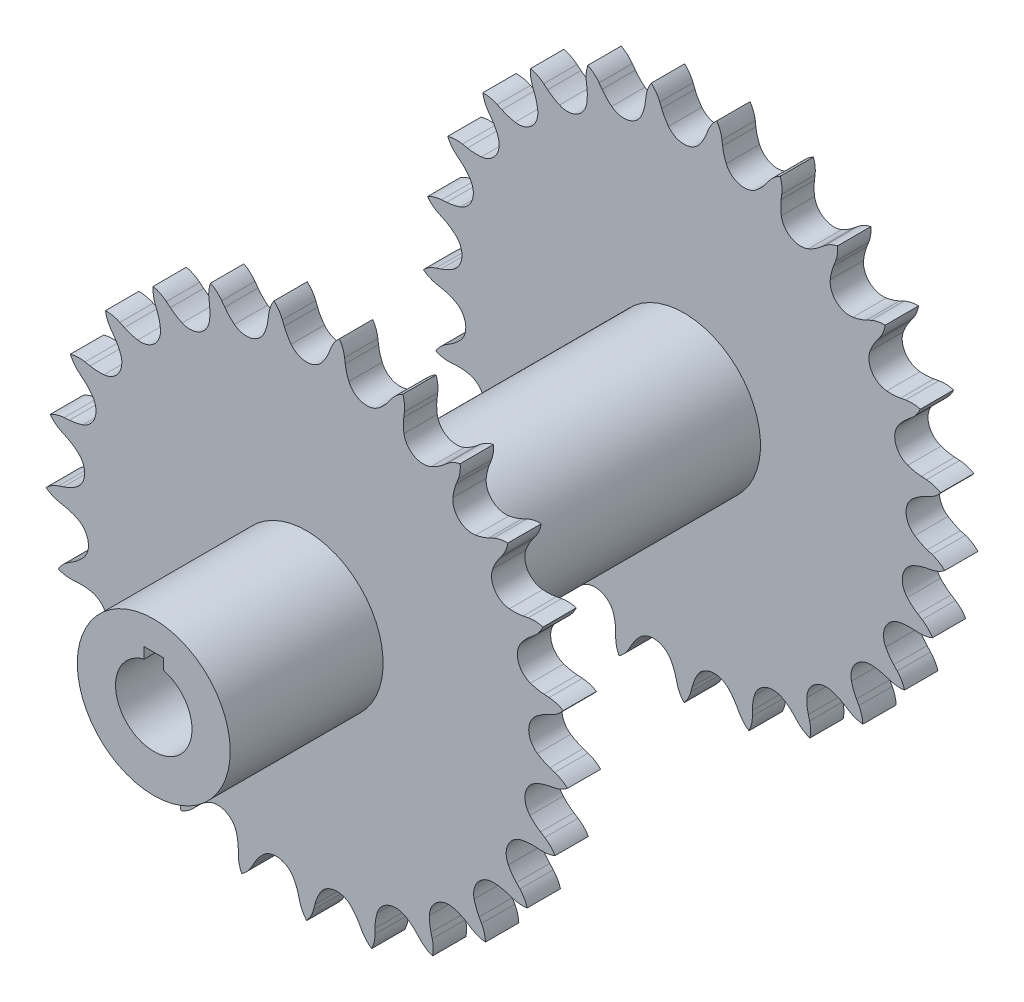
from build123d import *

# Parameters (mm, degrees)
BOSS_EXTRUDE1_DEPTH     = 8.712
SKETCH2_R               = 20
BOSS_EXTRUDE2_DEPTH     = 90
SKETCH4_R               = 20
BOSS_EXTRUDE3_DEPTH     = 40
CUT_EXTRUDE1_DEPTH      = 177.215580083
CUT_EXTRUDE1_DEPTH_BACK = 138.712


with BuildPart() as part:
    # Sketch1 → Boss-Extrude1 (new body)
    with BuildSketch(Plane.XY):
        with BuildLine():
            Line((5.857410324, 63.38143254), (6.35117384, 64.625997594))
            ThreePointArc((6.35117384, 64.625997594), (7.272282782, 66.3354149), (8.563342239, 67.785833699))
            ThreePointArc((8.563342239, 67.785833699), (9.453136201, 66.059909043), (9.920192015, 64.175125746))
            Line((9.920192015, 64.175125746), (10.088932299, 62.846866999))
            ThreePointArc((10.088932299, 62.846866999), (10.441933509, 61.06080873), (11.03646788, 59.340011568))
            ThreePointArc((11.03646788, 59.340011568), (14.476238332, 56.381225809), (18.915938066, 57.316907482))
            ThreePointArc((18.915938066, 57.316907482), (20.265932863, 58.538434412), (21.435710315, 59.933509574))
            Line((21.435710315, 59.933509574), (22.223472084, 61.016180335))
            ThreePointArc((22.223472084, 61.016180335), (23.540757492, 62.442822674), (25.151960429, 63.526600469))
            ThreePointArc((25.151960429, 63.526600469), (25.58457987, 61.63361615), (25.568235721, 59.691894728))
            Line((25.568235721, 59.691894728), (25.401350201, 58.36340167))
            ThreePointArc((25.401350201, 58.36340167), (25.2990866, 56.545667875), (25.446997729, 54.731078034))
            ThreePointArc((25.446997729, 54.731078034), (28.042881369, 51.009811845), (32.575794342, 50.811988931))
            ThreePointArc((32.575794342, 50.811988931), (34.187157965, 51.659409293), (35.667125791, 52.719743781))
            Line((35.667125791, 52.719743781), (36.699387845, 53.572492064))
            ThreePointArc((36.699387845, 53.572492064), (38.330079832, 54.626718251), (40.160188444, 55.275757296))
            ThreePointArc((40.160188444, 55.275757296), (40.108450292, 53.334656481), (39.609733144, 51.458002433))
            Line((39.609733144, 51.458002433), (39.11770785, 50.212749168))
            ThreePointArc((39.11770785, 50.212749168), (38.566605036, 48.477554747), (38.258599122, 46.683189581))
            ThreePointArc((38.258599122, 46.683189581), (39.847487036, 42.433263802), (44.188793654, 41.114366243))
            ThreePointArc((44.188793654, 41.114366243), (45.960278199, 41.534433498), (47.657444579, 42.193402597))
            Line((47.657444579, 42.193402597), (48.869346097, 42.76264709))
            ThreePointArc((48.869346097, 42.76264709), (50.710982288, 43.378216217), (52.645004119, 43.551735003))
            ThreePointArc((52.645004119, 43.551735003), (52.112159274, 41.684484195), (51.162405359, 39.990814595))
            Line((51.162405359, 39.990814595), (50.376156051, 38.907044967))
            ThreePointArc((50.376156051, 38.907044967), (49.41084184, 37.363418566), (48.666272027, 35.702024637))
            ThreePointArc((48.666272027, 35.702024637), (49.148328543, 31.190477736), (53.025248546, 28.833376716))
            ThreePointArc((53.025248546, 28.833376716), (54.845545125, 28.799696494), (56.653270853, 29.015894751))
            Line((56.653270853, 29.015894751), (57.968663604, 29.26586773))
            ThreePointArc((57.968663604, 29.26586773), (59.905527225, 29.404101324), (61.821940571, 29.091197028))
            ThreePointArc((61.821940571, 29.091197028), (60.841469634, 27.415122461), (59.500355483, 26.010856801))
            Line((59.500355483, 26.010856801), (58.469285096, 25.15666804))
            ThreePointArc((58.469285096, 25.15666804), (57.15041373, 23.901601383), (56.016064079, 22.477570182))
            ThreePointArc((56.016064079, 22.477570182), (55.360999814, 17.987879243), (58.529932058, 14.740680087))
            ThreePointArc((58.529932058, 14.740680087), (60.284664742, 14.255368641), (62.089363762, 14.015211525))
            Line((62.089363762, 14.015211525), (63.425596784, 13.930206269))
            ThreePointArc((63.425596784, 13.930206269), (65.335987569, 13.582418605), (67.114377132, 12.802752153))
            ThreePointArc((67.114377132, 12.802752153), (65.747886697, 11.423167758), (64.099679445, 10.396541213))
            Line((64.099679445, 10.396541213), (62.888573923, 9.825605141))
            ThreePointArc((62.888573923, 9.825605141), (61.299014942, 8.937958682), (59.846160812, 7.840767326))
            ThreePointArc((59.846160812, 7.840767326), (58.095135862, 3.655036142), (60.356964681, -0.278227683))
            ThreePointArc((60.356964681, -0.278227683), (61.935877163, -1.184676451), (63.624153598, -1.866098985))
            Line((63.624153598, -1.866098985), (64.897266455, -2.280741285))
            ThreePointArc((64.897266455, -2.280741285), (66.661147526, -3.092697429), (68.189770548, -4.290136724))
            ThreePointArc((68.189770548, -4.290136724), (66.523122236, -5.286546587), (64.671384805, -5.871027296))
            Line((64.671384805, -5.871027296), (63.356342363, -6.122836666))
            ThreePointArc((63.356342363, -6.122836666), (61.595973602, -6.587288835), (59.915903162, -7.288699777))
            ThreePointArc((59.915903162, -7.288699777), (57.178940865, -10.907466322), (58.391547236, -15.279653385))
            ThreePointArc((58.391547236, -15.279653385), (59.695430637, -16.550283965), (61.16120387, -17.630155634))
            Line((61.16120387, -17.630155634), (62.291202199, -18.348381475))
            ThreePointArc((62.291202199, -18.348381475), (63.79774242, -19.573487908), (64.980549896, -21.113460533))
            ThreePointArc((64.980549896, -21.113460533), (63.118465349, -21.664087767), (61.179549213, -21.769697567))
            Line((61.179549213, -21.769697567), (59.843198804, -21.686558126))
            ThreePointArc((59.843198804, -21.686558126), (58.022630707, -21.698632768), (56.220908962, -21.960191067))
            ThreePointArc((56.220908962, -21.960191067), (52.669982724, -24.784612562), (52.757174129, -29.32100227))
            ThreePointArc((52.757174129, -29.32100227), (53.704100659, -30.87597627), (54.855270768, -32.286444764))
            Line((54.855270768, -32.286444764), (55.771152617, -33.263125377))
            ThreePointArc((55.771152617, -33.263125377), (56.925690527, -34.824404156), (57.688362313, -36.610147967))
            ThreePointArc((57.688362313, -36.610147967), (55.747843151, -36.680394638), (53.843577542, -36.300497677))
            Line((53.843577542, -36.300497677), (52.569886977, -35.887633382))
            ThreePointArc((52.569886977, -35.887633382), (50.803512533, -35.446571802), (48.993348285, -35.251842789))
            ThreePointArc((48.993348285, -35.251842789), (44.851575862, -37.104450443), (43.807873744, -41.520004748))
            ThreePointArc((43.807873744, -41.520004748), (44.338344527, -43.261617431), (45.102579259, -44.914057829))
            Line((45.102579259, -44.914057829), (45.746796405, -46.087824778))
            ThreePointArc((45.746796405, -46.087824778), (46.47678814, -47.887175016), (46.771402762, -49.806485162))
            ThreePointArc((46.771402762, -49.806485162), (44.874378942, -49.391937413), (43.124415871, -48.550404014))
            Line((43.124415871, -48.550404014), (41.993415811, -47.833756647))
            ThreePointArc((41.993415811, -47.833756647), (40.392222824, -46.967272367), (38.687355351, -46.328491581))
            ThreePointArc((38.687355351, -46.328491581), (34.214979536, -47.092879243), (32.105963537, -51.110152627))
            ThreePointArc((32.105963537, -51.110152627), (32.186647144, -52.928972065), (32.515926821, -54.719555458))
            Line((32.515926821, -54.719555458), (32.84800073, -56.016656649))
            ThreePointArc((32.84800073, -56.016656649), (33.107578224, -57.941018553), (32.915623963, -59.873297718))
            ThreePointArc((32.915623963, -59.873297718), (31.181292467, -59.000003109), (29.69558855, -57.749709911))
            Line((29.69558855, -57.749709911), (28.77834389, -56.774309062))
            ThreePointArc((28.77834389, -56.774309062), (27.442941202, -55.536846475), (25.950493597, -54.494150863))
            ThreePointArc((25.950493597, -54.494150863), (21.428530212, -54.122289244), (18.386717564, -57.488861646))
            ThreePointArc((18.386717564, -57.488861646), (18.012544346, -59.270604724), (17.886179114, -61.086822173))
            Line((17.886179114, -61.086822173), (17.885244362, -62.425755968))
            ThreePointArc((17.885244362, -62.425755968), (17.658097408, -64.354214802), (16.991635455, -66.17805078))
            ThreePointArc((16.991635455, -66.17805078), (15.52897071, -64.900881624), (14.400878188, -63.320389145))
            Line((14.400878188, -63.320389145), (13.755022783, -62.147522837))
            ThreePointArc((13.755022783, -62.147522837), (12.769318657, -60.616836269), (11.583066892, -59.23574223))
            ThreePointArc((11.583066892, -59.23574223), (7.295647526, -57.750996764), (3.512166505, -60.25533406))
            ThreePointArc((3.512166505, -60.25533406), (2.706647142, -61.888047307), (2.132576994, -63.615779189))
            Line((2.132576994, -63.615779189), (1.798692314, -64.912415454))
            ThreePointArc((1.798692314, -64.912415454), (1.099093389, -66.723799057), (0, -68.324593526))
            ThreePointArc((0, -68.324593526), (-1.099093389, -66.723799057), (-1.798692314, -64.912415454))
            Line((-1.798692314, -64.912415454), (-2.132576994, -63.615779189))
            ThreePointArc((-2.132576994, -63.615779189), (-2.706647142, -61.888047307), (-3.512166505, -60.25533406))
            ThreePointArc((-3.512166505, -60.25533406), (-7.295647526, -57.750996764), (-11.583066892, -59.23574223))
            ThreePointArc((-11.583066892, -59.23574223), (-12.769318657, -60.616836269), (-13.755022783, -62.147522837))
            Line((-13.755022783, -62.147522837), (-14.400878188, -63.320389145))
            ThreePointArc((-14.400878188, -63.320389145), (-15.52897071, -64.900881624), (-16.991635455, -66.17805078))
            ThreePointArc((-16.991635455, -66.17805078), (-17.658097408, -64.354214802), (-17.885244362, -62.425755968))
            Line((-17.885244362, -62.425755968), (-17.886179114, -61.086822173))
            ThreePointArc((-17.886179114, -61.086822173), (-18.012544346, -59.270604724), (-18.386717564, -57.488861646))
            ThreePointArc((-18.386717564, -57.488861646), (-21.428530212, -54.122289244), (-25.950493597, -54.494150863))
            ThreePointArc((-25.950493597, -54.494150863), (-27.442941202, -55.536846475), (-28.77834389, -56.774309062))
            Line((-28.77834389, -56.774309062), (-29.69558855, -57.749709911))
            ThreePointArc((-29.69558855, -57.749709911), (-31.181292467, -59.000003109), (-32.915623963, -59.873297718))
            ThreePointArc((-32.915623963, -59.873297718), (-33.107578224, -57.941018553), (-32.84800073, -56.016656649))
            Line((-32.84800073, -56.016656649), (-32.515926821, -54.719555458))
            ThreePointArc((-32.515926821, -54.719555458), (-32.186647144, -52.928972065), (-32.105963537, -51.110152627))
            ThreePointArc((-32.105963537, -51.110152627), (-34.214979536, -47.092879243), (-38.687355351, -46.328491581))
            ThreePointArc((-38.687355351, -46.328491581), (-40.392222824, -46.967272367), (-41.993415811, -47.833756647))
            Line((-41.993415811, -47.833756647), (-43.124415871, -48.550404014))
            ThreePointArc((-43.124415871, -48.550404014), (-44.874378942, -49.391937413), (-46.771402762, -49.806485162))
            ThreePointArc((-46.771402762, -49.806485162), (-46.47678814, -47.887175016), (-45.746796405, -46.087824778))
            Line((-45.746796405, -46.087824778), (-45.102579259, -44.914057829))
            ThreePointArc((-45.102579259, -44.914057829), (-44.338344527, -43.261617431), (-43.807873744, -41.520004748))
            ThreePointArc((-43.807873744, -41.520004748), (-44.851575862, -37.104450443), (-48.993348285, -35.251842789))
            ThreePointArc((-48.993348285, -35.251842789), (-50.803512533, -35.446571802), (-52.569886977, -35.887633382))
            Line((-52.569886977, -35.887633382), (-53.843577542, -36.300497677))
            ThreePointArc((-53.843577542, -36.300497677), (-55.747843151, -36.680394638), (-57.688362313, -36.610147967))
            ThreePointArc((-57.688362313, -36.610147967), (-56.925690527, -34.824404156), (-55.771152617, -33.263125377))
            Line((-55.771152617, -33.263125377), (-54.855270768, -32.286444764))
            ThreePointArc((-54.855270768, -32.286444764), (-53.704100659, -30.87597627), (-52.757174129, -29.32100227))
            ThreePointArc((-52.757174129, -29.32100227), (-52.669982724, -24.784612562), (-56.220908962, -21.960191067))
            ThreePointArc((-56.220908962, -21.960191067), (-58.022630707, -21.698632768), (-59.843198804, -21.686558126))
            Line((-59.843198804, -21.686558126), (-61.179549213, -21.769697567))
            ThreePointArc((-61.179549213, -21.769697567), (-63.118465349, -21.664087767), (-64.980549896, -21.113460533))
            ThreePointArc((-64.980549896, -21.113460533), (-63.79774242, -19.573487908), (-62.291202199, -18.348381475))
            Line((-62.291202199, -18.348381475), (-61.16120387, -17.630155634))
            ThreePointArc((-61.16120387, -17.630155634), (-59.695430637, -16.550283965), (-58.391547236, -15.279653385))
            ThreePointArc((-58.391547236, -15.279653385), (-57.178940865, -10.907466322), (-59.915903162, -7.288699777))
            ThreePointArc((-59.915903162, -7.288699777), (-61.595973602, -6.587288835), (-63.356342363, -6.122836666))
            Line((-63.356342363, -6.122836666), (-64.671384805, -5.871027296))
            ThreePointArc((-64.671384805, -5.871027296), (-66.523122236, -5.286546587), (-68.189770548, -4.290136724))
            ThreePointArc((-68.189770548, -4.290136724), (-66.661147526, -3.092697429), (-64.897266455, -2.280741285))
            Line((-64.897266455, -2.280741285), (-63.624153598, -1.866098985))
            ThreePointArc((-63.624153598, -1.866098985), (-61.935877163, -1.184676451), (-60.356964681, -0.278227683))
            ThreePointArc((-60.356964681, -0.278227683), (-58.095135862, 3.655036142), (-59.846160812, 7.840767326))
            ThreePointArc((-59.846160812, 7.840767326), (-61.299014942, 8.937958682), (-62.888573923, 9.825605141))
            Line((-62.888573923, 9.825605141), (-64.099679445, 10.396541213))
            ThreePointArc((-64.099679445, 10.396541213), (-65.747886697, 11.423167758), (-67.114377132, 12.802752153))
            ThreePointArc((-67.114377132, 12.802752153), (-65.335987569, 13.582418605), (-63.425596784, 13.930206269))
            Line((-63.425596784, 13.930206269), (-62.089363762, 14.015211525))
            ThreePointArc((-62.089363762, 14.015211525), (-60.284664742, 14.255368641), (-58.529932058, 14.740680087))
            ThreePointArc((-58.529932058, 14.740680087), (-55.360999814, 17.987879243), (-56.016064079, 22.477570182))
            ThreePointArc((-56.016064079, 22.477570182), (-57.15041373, 23.901601383), (-58.469285096, 25.15666804))
            Line((-58.469285096, 25.15666804), (-59.500355483, 26.010856801))
            ThreePointArc((-59.500355483, 26.010856801), (-60.841469634, 27.415122461), (-61.821940571, 29.091197028))
            ThreePointArc((-61.821940571, 29.091197028), (-59.905527225, 29.404101324), (-57.968663604, 29.26586773))
            Line((-57.968663604, 29.26586773), (-56.653270853, 29.015894751))
            ThreePointArc((-56.653270853, 29.015894751), (-54.845545125, 28.799696494), (-53.025248546, 28.833376716))
            ThreePointArc((-53.025248546, 28.833376716), (-49.148328543, 31.190477736), (-48.666272027, 35.702024637))
            ThreePointArc((-48.666272027, 35.702024637), (-49.41084184, 37.363418566), (-50.376156051, 38.907044967))
            Line((-50.376156051, 38.907044967), (-51.162405359, 39.990814595))
            ThreePointArc((-51.162405359, 39.990814595), (-52.112159274, 41.684484195), (-52.645004119, 43.551735003))
            ThreePointArc((-52.645004119, 43.551735003), (-50.710982288, 43.378216217), (-48.869346097, 42.76264709))
            Line((-48.869346097, 42.76264709), (-47.657444579, 42.193402597))
            ThreePointArc((-47.657444579, 42.193402597), (-45.960278199, 41.534433498), (-44.188793654, 41.114366243))
            ThreePointArc((-44.188793654, 41.114366243), (-39.847487036, 42.433263802), (-38.258599122, 46.683189581))
            ThreePointArc((-38.258599122, 46.683189581), (-38.566605036, 48.477554747), (-39.11770785, 50.212749168))
            Line((-39.11770785, 50.212749168), (-39.609733144, 51.458002433))
            ThreePointArc((-39.609733144, 51.458002433), (-40.108450292, 53.334656481), (-40.160188444, 55.275757296))
            ThreePointArc((-40.160188444, 55.275757296), (-38.330079832, 54.626718251), (-36.699387845, 53.572492064))
            Line((-36.699387845, 53.572492064), (-35.667125791, 52.719743781))
            ThreePointArc((-35.667125791, 52.719743781), (-34.187157965, 51.659409293), (-32.575794342, 50.811988931))
            ThreePointArc((-32.575794342, 50.811988931), (-28.042881369, 51.009811845), (-25.446997729, 54.731078034))
            ThreePointArc((-25.446997729, 54.731078034), (-25.2990866, 56.545667875), (-25.401350201, 58.36340167))
            Line((-25.401350201, 58.36340167), (-25.568235721, 59.691894728))
            ThreePointArc((-25.568235721, 59.691894728), (-25.58457987, 61.63361615), (-25.151960429, 63.526600469))
            ThreePointArc((-25.151960429, 63.526600469), (-23.540757492, 62.442822674), (-22.223472084, 61.016180335))
            Line((-22.223472084, 61.016180335), (-21.435710315, 59.933509574))
            ThreePointArc((-21.435710315, 59.933509574), (-20.265932863, 58.538434412), (-18.915938066, 57.316907482))
            ThreePointArc((-18.915938066, 57.316907482), (-14.476238332, 56.381225809), (-11.03646788, 59.340011568))
            ThreePointArc((-11.03646788, 59.340011568), (-10.441933509, 61.06080873), (-10.088932299, 62.846866999))
            Line((-10.088932299, 62.846866999), (-9.920192015, 64.175125746))
            ThreePointArc((-9.920192015, 64.175125746), (-9.453136201, 66.059909043), (-8.563342239, 67.785833699))
            ThreePointArc((-8.563342239, 67.785833699), (-7.272282782, 66.3354149), (-6.35117384, 64.625997594))
            Line((-6.35117384, 64.625997594), (-5.857410324, 63.38143254))
            ThreePointArc((-5.857410324, 63.38143254), (-5.071324667, 61.739274407), (-4.067523834, 60.220393938))
            ThreePointArc((-4.067523834, 60.220393938), (0, 58.21), (4.067523834, 60.220393938))
            ThreePointArc((4.067523834, 60.220393938), (5.071324667, 61.739274407), (5.857410324, 63.38143254))
        make_face()
    boss_extrude1 = extrude(amount=BOSS_EXTRUDE1_DEPTH)

    # Sketch2 → Boss-Extrude2 (add)
    with BuildSketch(Plane.XY.offset(8.712)):
        with Locations(Location((0, 0, 0), (0, 0, 180))):
            Circle(SKETCH2_R)
    extrude(amount=BOSS_EXTRUDE2_DEPTH)

    # Mirror1: Boss-Extrude1 across plane
    add(boss_extrude1.mirror(Plane.XY.offset(53.712)))

    # Sketch4 → Boss-Extrude3 (add)
    with BuildSketch(Plane.XY.offset(107.424)):
        with Locations(Location((0, 0, 0), (0, 0, 180))):
            Circle(SKETCH4_R)
    extrude(amount=BOSS_EXTRUDE3_DEPTH)

    # Sketch5 → Cut-Extrude1 (cut, two sides: drawn at the far end of the back side and taken through both)
    with BuildSketch(Plane.XY.offset(147.424).offset(-CUT_EXTRUDE1_DEPTH_BACK)):
        with BuildLine():
            Line((-2.5, 12.5), (2.5, 12.5))
            Line((2.5, 12.5), (2.5, 9.682458366))
            ThreePointArc((2.5, 9.682458366), (0, -10), (-2.5, 9.682458366))
            Line((-2.5, 9.682458366), (-2.5, 12.5))
        make_face()
    extrude(amount=CUT_EXTRUDE1_DEPTH + CUT_EXTRUDE1_DEPTH_BACK, mode=Mode.SUBTRACT)


solid = part.part
